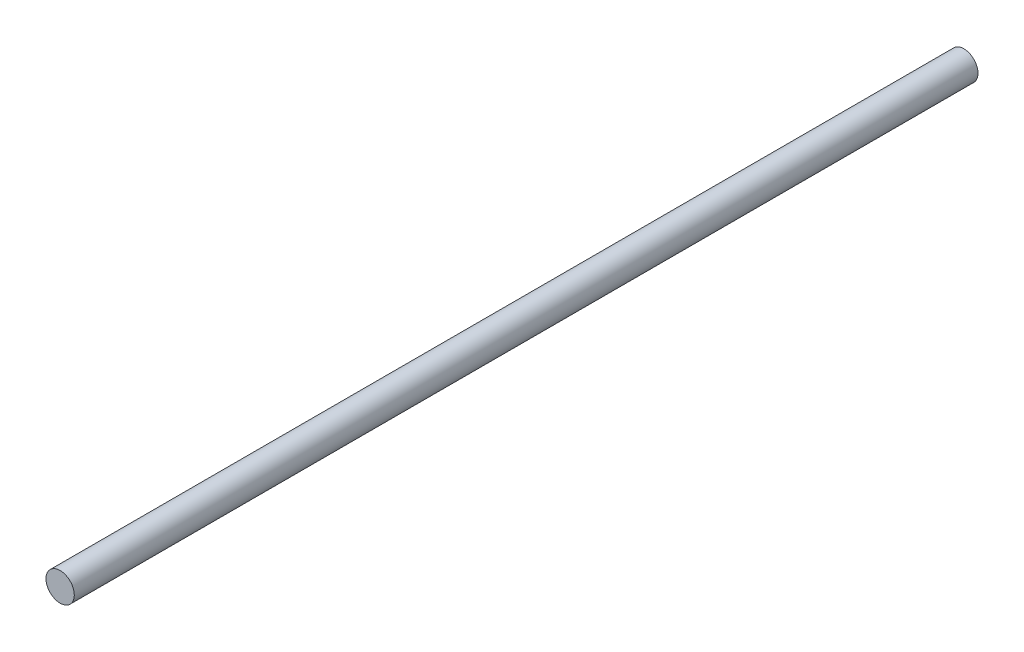
from build123d import *

# Parameters (mm, degrees)
SKETCH1_R           = 4.7
BOSS_EXTRUDE1_DEPTH = 300


with BuildPart() as part:
    # Sketch1 → Boss-Extrude1 (new body)
    with BuildSketch(Plane.XY):
        Circle(SKETCH1_R)
    extrude(amount=BOSS_EXTRUDE1_DEPTH)


solid = part.part
